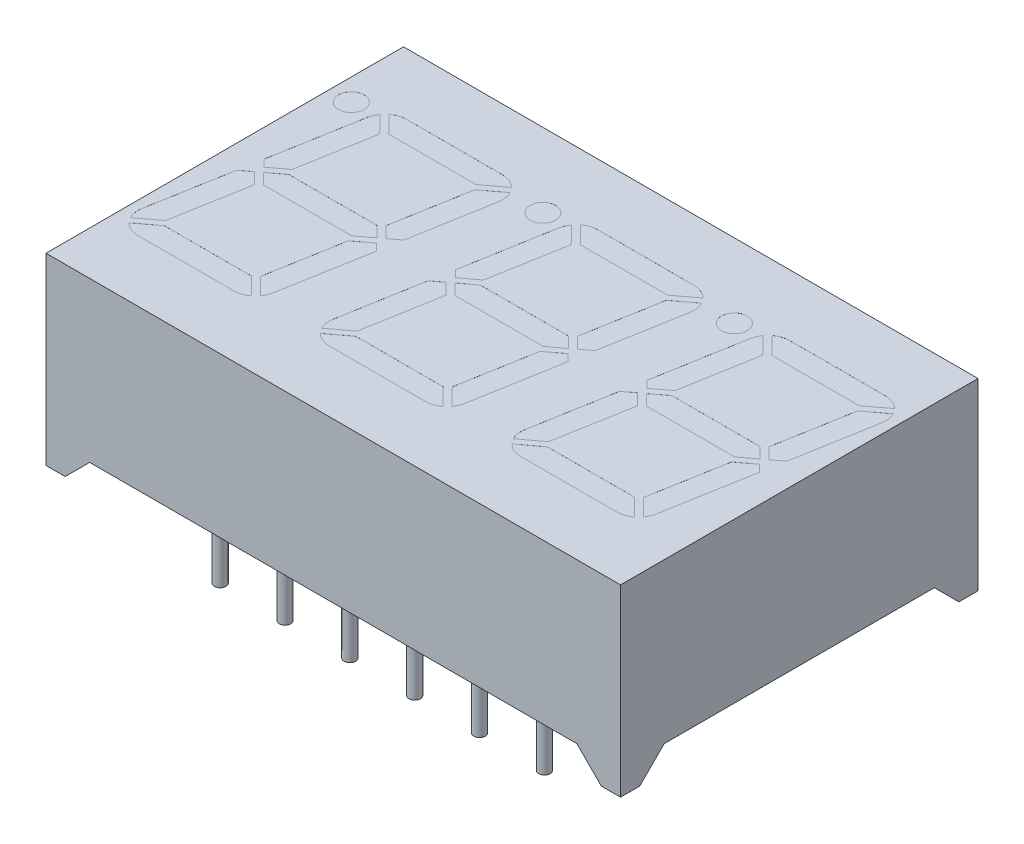
from build123d import *

# Parameters (mm, degrees)
SKETCH1_W                   = 22.5
SKETCH1_H                   = 14
BOSS_EXTRUDE1_DEPTH         = 7.2
CUT_EXTRUDE1_DEPTH          = 16.079870689
CUT_EXTRUDE1_DEPTH_BACK     = 16.079870689
CUT_EXTRUDE2_DEPTH          = 16.079870689
CUT_EXTRUDE2_DEPTH_BACK     = 16.079870689
SKETCH4_W                   = 22.1
SKETCH4_H                   = 13.6
CUT_EXTRUDE3_DEPTH          = 0.96
BOSS_EXTRUDE2_DEPTH         = 0.96
BOSS_EXTRUDE2_DEPTH_BACK    = 2.5
SKETCH5_R                   = 0.225
BOSS_EXTRUDE2_2_DEPTH       = 0.96
BOSS_EXTRUDE2_2_DEPTH_BACK  = 2.5
BOSS_EXTRUDE2_3_DEPTH       = 0.96
BOSS_EXTRUDE2_3_DEPTH_BACK  = 2.5
BOSS_EXTRUDE2_4_DEPTH       = 0.96
BOSS_EXTRUDE2_4_DEPTH_BACK  = 2.5
BOSS_EXTRUDE2_5_DEPTH       = 0.96
BOSS_EXTRUDE2_5_DEPTH_BACK  = 2.5
BOSS_EXTRUDE2_6_DEPTH       = 0.96
BOSS_EXTRUDE2_6_DEPTH_BACK  = 2.5
BOSS_EXTRUDE2_7_DEPTH       = 0.96
BOSS_EXTRUDE2_7_DEPTH_BACK  = 2.5
BOSS_EXTRUDE2_8_DEPTH       = 0.96
BOSS_EXTRUDE2_8_DEPTH_BACK  = 2.5
BOSS_EXTRUDE2_9_DEPTH       = 0.96
BOSS_EXTRUDE2_9_DEPTH_BACK  = 2.5
BOSS_EXTRUDE2_10_DEPTH      = 0.96
BOSS_EXTRUDE2_10_DEPTH_BACK = 2.5
BOSS_EXTRUDE2_11_DEPTH      = 0.96
BOSS_EXTRUDE2_11_DEPTH_BACK = 2.5
BOSS_EXTRUDE2_12_DEPTH      = 0.96
BOSS_EXTRUDE2_12_DEPTH_BACK = 2.5
SKETCH6_R                   = 0.5
CUT_EXTRUDE4_DEPTH          = 0.001
CUT_EXTRUDE5_DEPTH          = 0.001


with BuildPart() as part:
    # Sketch1 → Boss-Extrude1 (new body)
    with BuildSketch(Plane(origin=(0, 0, 0), x_dir=(1, 0, 0), z_dir=(0, 1, 0))):
        Rectangle(SKETCH1_W, SKETCH1_H)
    extrude(amount=BOSS_EXTRUDE1_DEPTH)

    # Sketch2 → Cut-Extrude1 (cut, two sides: drawn at the far end of the back side and taken through both)
    with BuildSketch(Plane.XY.offset(-CUT_EXTRUDE1_DEPTH_BACK)):
        Polygon((-10.5, 0), (-9.54, 0.96), (9.54, 0.96), (10.5, 0), align=None)
    extrude(amount=CUT_EXTRUDE1_DEPTH + CUT_EXTRUDE1_DEPTH_BACK, mode=Mode.SUBTRACT)

    # Sketch3 → Cut-Extrude2 (cut, two sides: drawn at the far end of the back side and taken through both)
    with BuildSketch(Plane(origin=(0, 0, 0), x_dir=(0, 0, -1), z_dir=(1, 0, 0)).offset(-CUT_EXTRUDE2_DEPTH_BACK)):
        Polygon((-6.25, 0), (-5.29, 0.96), (5.29, 0.96), (6.25, 0), align=None)
    extrude(amount=CUT_EXTRUDE2_DEPTH + CUT_EXTRUDE2_DEPTH_BACK, mode=Mode.SUBTRACT)

    # Sketch4 → Cut-Extrude3 (cut)
    with BuildSketch(Plane(origin=(0, 0, 0), x_dir=(1, 0, 0), z_dir=(0, 1, 0))):
        Rectangle(SKETCH4_W, SKETCH4_H)
    extrude(amount=CUT_EXTRUDE3_DEPTH, mode=Mode.SUBTRACT)

    # Sketch6 → Cut-Extrude4 (cut)
    with BuildSketch(Plane(origin=(0, 7.2, 0), x_dir=(1, 0, 0), z_dir=(0, 1, 0))):
        with Locations(Location((-10.392058442, 4.1, 0), (0, 0, 270))):
            Circle(SKETCH6_R)
        with Locations(Location((-2.892058442, 4.1, 0), (0, 0, 270))):
            Circle(SKETCH6_R)
        with Locations(Location((4.607941558, 4.1, 0), (0, 0, 270))):
            Circle(SKETCH6_R)
        with BuildLine():
            Line((-8.727547645, 4.6), (-4.970469181, 4.6))
            ThreePointArc((-4.970469181, 4.6), (-4.641426562, 4.533728879), (-4.363692234, 4.345249307))
            Line((-4.363692234, 4.345249307), (-5.155888885, 3.75))
            Line((-5.155888885, 3.75), (-8.578503163, 3.75))
            Line((-8.578503163, 3.75), (-9.237376372, 4.43012842))
            ThreePointArc((-9.237376372, 4.43012842), (-8.996239701, 4.556414644), (-8.727547645, 4.6))
        make_face()
        with BuildLine():
            Line((-4.133382591, 3.602399049), (-4.688947917, 0.451631512))
            Line((-4.688947917, 0.451631512), (-5.090743822, 0.149725749))
            Line((-5.090743822, 0.149725749), (-5.526060401, 0.599085615))
            Line((-5.526060401, 0.599085615), (-5.005711035, 3.550133511))
            Line((-5.005711035, 3.550133511), (-4.216751701, 4.142950328))
            ThreePointArc((-4.216751701, 4.142950328), (-4.130401732, 3.879563426), (-4.133382591, 3.602399049))
        make_face()
        with BuildLine():
            Line((-6.292921536, -4.6), (-10.05, -4.6))
            ThreePointArc((-10.05, -4.6), (-10.379042618, -4.533728879), (-10.656776946, -4.345249307))
            Line((-10.656776946, -4.345249307), (-9.864580296, -3.75))
            Line((-9.864580296, -3.75), (-6.441809911, -3.75))
            Line((-6.441809911, -3.75), (-5.783002379, -4.430060624))
            ThreePointArc((-5.783002379, -4.430060624), (-6.024175867, -4.556396779), (-6.292921536, -4.6))
        make_face()
        with BuildLine():
            Line((-10.88708659, -3.602399049), (-10.331521263, -0.451631512))
            Line((-10.331521263, -0.451631512), (-9.929635014, -0.149657865))
            Line((-9.929635014, -0.149657865), (-9.494384741, -0.598949286))
            Line((-9.494384741, -0.598949286), (-10.014758145, -3.550133511))
            Line((-10.014758145, -3.550133511), (-10.80371748, -4.142950328))
            ThreePointArc((-10.80371748, -4.142950328), (-10.890067449, -3.879563426), (-10.88708659, -3.602399049))
        make_face()
        with BuildLine():
            Line((-1.227547645, 4.6), (2.529530819, 4.6))
            ThreePointArc((2.529530819, 4.6), (2.858573438, 4.533728879), (3.136307766, 4.345249307))
            Line((3.136307766, 4.345249307), (2.344111115, 3.75))
            Line((2.344111115, 3.75), (-1.078503163, 3.75))
            Line((-1.078503163, 3.75), (-1.737376372, 4.43012842))
            ThreePointArc((-1.737376372, 4.43012842), (-1.496239701, 4.556414644), (-1.227547645, 4.6))
        make_face()
        with BuildLine():
            Line((-1.913379044, 4.252130751), (-1.258251642, 3.575868977))
            Line((-1.258251642, 3.575868977), (-1.773029585, 0.65641819))
            Line((-1.773029585, 0.65641819), (-2.403512913, 0.182678792))
            Line((-2.403512913, 0.182678792), (-2.670990276, 0.458784959))
            Line((-2.670990276, 0.458784959), (-2.064634235, 3.897600951))
            ThreePointArc((-2.064634235, 3.897600951), (-2.00936773, 4.083552626), (-1.913379044, 4.252130751))
        make_face()
        with BuildLine():
            Line((-9.413379044, 4.252130751), (-8.758251642, 3.575868977))
            Line((-8.758251642, 3.575868977), (-9.273029585, 0.65641819))
            Line((-9.273029585, 0.65641819), (-9.903512913, 0.182678792))
            Line((-9.903512913, 0.182678792), (-10.170990276, 0.458784959))
            Line((-10.170990276, 0.458784959), (-9.564634235, 3.897600951))
            ThreePointArc((-9.564634235, 3.897600951), (-9.50936773, 4.083552626), (-9.413379044, 4.252130751))
        make_face()
        Polygon((-2.22819342, 0.001703503), (-1.664903231, 0.424954592), (1.79419112, 0.424954592), (2.207603376, -0.001794319), (1.644313187, -0.425045408), (-1.814781164, -0.425045408), align=None)
        Polygon((-9.72819342, 0.001703503), (-9.164903231, 0.424954592), (-5.70580888, 0.424954592), (-5.292396624, -0.001794319), (-5.855686813, -0.425045408), (-9.314781164, -0.425045408), align=None)
        with BuildLine():
            Line((-6.262249697, -3.57605136), (-5.607180041, -4.252253524))
            ThreePointArc((-5.607180041, -4.252253524), (-5.511131311, -4.083622607), (-5.455834946, -3.897600951))
            Line((-5.455834946, -3.897600951), (-4.849511064, -0.458967341))
            Line((-4.849511064, -0.458967341), (-5.117077131, -0.182769608))
            Line((-5.117077131, -0.182769608), (-5.747439596, -0.65641819))
            Line((-5.747439596, -0.65641819), (-6.262249697, -3.57605136))
        make_face()
        with BuildLine():
            Line((-2.831521263, -0.451631512), (-2.429635014, -0.149657865))
            Line((-2.429635014, -0.149657865), (-1.994384741, -0.598949286))
            Line((-1.994384741, -0.598949286), (-2.514758145, -3.550133511))
            Line((-2.514758145, -3.550133511), (-3.30371748, -4.142950328))
            ThreePointArc((-3.30371748, -4.142950328), (-3.390067449, -3.879563426), (-3.38708659, -3.602399049))
            Line((-3.38708659, -3.602399049), (-2.831521263, -0.451631512))
        make_face()
        with BuildLine():
            Line((-3.156776946, -4.345249307), (-2.364580296, -3.75))
            Line((-2.364580296, -3.75), (1.058190089, -3.75))
            Line((1.058190089, -3.75), (1.716997621, -4.430060624))
            ThreePointArc((1.716997621, -4.430060624), (1.475824133, -4.556396779), (1.207078464, -4.6))
            Line((1.207078464, -4.6), (-2.55, -4.6))
            ThreePointArc((-2.55, -4.6), (-2.879042618, -4.533728879), (-3.156776946, -4.345249307))
        make_face()
        with BuildLine():
            Line((1.237750303, -3.57605136), (1.892819959, -4.252253524))
            ThreePointArc((1.892819959, -4.252253524), (1.988868689, -4.083622607), (2.044165054, -3.897600951))
            Line((2.044165054, -3.897600951), (2.650488936, -0.458967341))
            Line((2.650488936, -0.458967341), (2.382922869, -0.182769608))
            Line((2.382922869, -0.182769608), (1.752560404, -0.65641819))
            Line((1.752560404, -0.65641819), (1.237750303, -3.57605136))
        make_face()
        with BuildLine():
            Line((1.973939599, 0.599085615), (2.409256178, 0.149725749))
            Line((2.409256178, 0.149725749), (2.811052083, 0.451631512))
            Line((2.811052083, 0.451631512), (3.366617409, 3.602399049))
            ThreePointArc((3.366617409, 3.602399049), (3.369598268, 3.879563426), (3.283248299, 4.142950328))
            Line((3.283248299, 4.142950328), (2.494288965, 3.550133511))
            Line((2.494288965, 3.550133511), (1.973939599, 0.599085615))
        make_face()
        with BuildLine():
            Line((6.272452355, 4.6), (10.029530819, 4.6))
            ThreePointArc((10.029530819, 4.6), (10.358573438, 4.533728879), (10.636307766, 4.345249307))
            Line((10.636307766, 4.345249307), (9.844111115, 3.75))
            Line((9.844111115, 3.75), (6.421496837, 3.75))
            Line((6.421496837, 3.75), (5.762623628, 4.43012842))
            ThreePointArc((5.762623628, 4.43012842), (6.003760299, 4.556414644), (6.272452355, 4.6))
        make_face()
        with BuildLine():
            Line((5.586620956, 4.252130751), (6.241748358, 3.575868977))
            Line((6.241748358, 3.575868977), (5.726970415, 0.65641819))
            Line((5.726970415, 0.65641819), (5.096487087, 0.182678792))
            Line((5.096487087, 0.182678792), (4.829009724, 0.458784959))
            Line((4.829009724, 0.458784959), (5.435365765, 3.897600951))
            ThreePointArc((5.435365765, 3.897600951), (5.49063227, 4.083552626), (5.586620956, 4.252130751))
        make_face()
        Polygon((5.27180658, 0.001703503), (5.835096769, 0.424954592), (9.29419112, 0.424954592), (9.707603376, -0.001794319), (9.144313187, -0.425045408), (5.685218836, -0.425045408), align=None)
        with BuildLine():
            Line((4.668478737, -0.451631512), (5.070364986, -0.149657865))
            Line((5.070364986, -0.149657865), (5.505615259, -0.598949286))
            Line((5.505615259, -0.598949286), (4.985241855, -3.550133511))
            Line((4.985241855, -3.550133511), (4.19628252, -4.142950328))
            ThreePointArc((4.19628252, -4.142950328), (4.109932551, -3.879563426), (4.11291341, -3.602399049))
            Line((4.11291341, -3.602399049), (4.668478737, -0.451631512))
        make_face()
        with BuildLine():
            Line((4.343223054, -4.345249307), (5.135419704, -3.75))
            Line((5.135419704, -3.75), (8.558190089, -3.75))
            Line((8.558190089, -3.75), (9.216997621, -4.430060624))
            ThreePointArc((9.216997621, -4.430060624), (8.975824133, -4.556396779), (8.707078464, -4.6))
            Line((8.707078464, -4.6), (4.95, -4.6))
            ThreePointArc((4.95, -4.6), (4.620957382, -4.533728879), (4.343223054, -4.345249307))
        make_face()
        with BuildLine():
            Line((8.737750303, -3.57605136), (9.392819959, -4.252253524))
            ThreePointArc((9.392819959, -4.252253524), (9.488868689, -4.083622607), (9.544165054, -3.897600951))
            Line((9.544165054, -3.897600951), (10.150488936, -0.458967341))
            Line((10.150488936, -0.458967341), (9.882922869, -0.182769608))
            Line((9.882922869, -0.182769608), (9.252560404, -0.65641819))
            Line((9.252560404, -0.65641819), (8.737750303, -3.57605136))
        make_face()
        with BuildLine():
            Line((9.473939599, 0.599085615), (9.909256178, 0.149725749))
            Line((9.909256178, 0.149725749), (10.311052083, 0.451631512))
            Line((10.311052083, 0.451631512), (10.866617409, 3.602399049))
            ThreePointArc((10.866617409, 3.602399049), (10.869598268, 3.879563426), (10.783248299, 4.142950328))
            Line((10.783248299, 4.142950328), (9.994288965, 3.550133511))
            Line((9.994288965, 3.550133511), (9.473939599, 0.599085615))
        make_face()
    extrude(amount=-CUT_EXTRUDE4_DEPTH, mode=Mode.SUBTRACT)

    # Sketch7 → Cut-Extrude5 (cut)
    # profile 1 of 8: a face of its own
    with BuildSketch(Plane(origin=(0, 0, -7), x_dir=(-1, 0, 0), z_dir=(0, 0, -1))):
        with BuildLine():
            add(Edge.make_bspline(
                [(-6.587555337, 4.961124035), (-6.593219589, 4.967236914), (-6.604393745, 4.979296098), (-6.615160312, 5.001355167), (-6.62227472, 5.024800281), (-6.624655613, 5.049671139), (-6.622177743, 5.074691882), (-6.615323655, 5.098449351), (-6.604278793, 5.120539824), (-6.587949392, 5.139207064), (-6.569277137, 5.155555768), (-6.547187336, 5.166530211), (-6.523432095, 5.173650544), (-6.506856785, 5.174606093), (-6.498401377, 5.175093538)],
                knots=[0, 0, 0, 0, 1.009905308, 1.992290989, 2.955785953, 3.984032444, 5.012278935, 5.999725233, 6.982110915, 7.992016222, 9.00192153, 9.984307211, 10.971753509, 12, 12, 12, 12], degree=3))
            Line((-6.498401377, 5.175093538), (-5.873708805, 5.175093538))
            Line((-5.873708805, 5.175093538), (-5.248401377, 5.175093538))
            add(Edge.make_bspline(
                [(-5.248401377, 5.175093538), (-5.23995072, 5.174596897), (-5.223384722, 5.173623321), (-5.199737719, 5.166685451), (-5.178045317, 5.155351417), (-5.159456573, 5.139230017), (-5.143141878, 5.120533899), (-5.132093008, 5.098450791), (-5.125240638, 5.074691995), (-5.122759806, 5.049669081), (-5.125150627, 5.024808161), (-5.132230268, 5.001327493), (-5.14312838, 4.979403152), (-5.159460238, 4.960712225), (-5.17804439, 4.944589437), (-5.199737968, 4.933255758), (-5.223384656, 4.926317793), (-5.239950698, 4.92534423), (-5.248401377, 4.924847596)],
                knots=[0, 0, 0, 0, 1.030583013, 2.020273121, 2.982711463, 3.994911615, 5.007111767, 5.991729759, 6.981419867, 8.01200288, 9.042585892, 10.008270241, 10.992888233, 12.005088385, 13.017288537, 13.979726879, 14.969416987, 16, 16, 16, 16], degree=3))
            Line((-5.248401377, 4.924847596), (-5.748893261, 4.924847596))
            Line((-5.748893261, 4.924847596), (-5.748893261, 2.799909081))
            add(Edge.make_bspline(
                [(-5.748893261, 2.799909081), (-5.749356, 2.791446979), (-5.750252337, 2.775055657), (-5.757592417, 2.751572761), (-5.768420574, 2.729650289), (-5.784771755, 2.710953958), (-5.803350955, 2.694850646), (-5.825045019, 2.683447217), (-5.84869459, 2.676777516), (-5.873698734, 2.674259605), (-5.898565288, 2.676660073), (-5.922042398, 2.683738297), (-5.943975787, 2.694632934), (-5.962633076, 2.710980583), (-5.979000357, 2.72964337), (-5.989824338, 2.751574542), (-5.997165501, 2.775055181), (-5.998061688, 2.791446817), (-5.998524348, 2.799909081)],
                knots=[0, 0, 0, 0, 1.032249571, 1.999495531, 2.985705751, 3.999542735, 5.013379718, 5.977374421, 6.96866496, 8.000914531, 9.033164102, 10.000410062, 10.986620282, 12.000457265, 13.014294249, 14.000504469, 14.967750429, 16, 16, 16, 16], degree=3))
            Line((-5.998524348, 2.799909081), (-5.998524348, 4.924847596))
            Line((-5.998524348, 4.924847596), (-6.498401377, 4.924847596))
            add(Edge.make_bspline(
                [(-6.498401377, 4.924847596), (-6.506859188, 4.925332663), (-6.523439209, 4.926283549), (-6.54716025, 4.933437728), (-6.569379462, 4.944284103), (-6.581441175, 4.95545927), (-6.587555337, 4.961124035)],
                knots=[0, 0, 0, 0, 1.026198256, 2.011677592, 2.992106392, 4, 4, 4, 4], degree=3))
        make_face()
    # profile 2 of 8: a face of its own
    with BuildSketch(Plane(origin=(0, 0, -7), x_dir=(-1, 0, 0), z_dir=(0, 0, -1))):
        with BuildLine():
            add(Edge.make_bspline(
                [(-4.572060994, 5.029987783), (-4.553510328, 5.047548182), (-4.517001144, 5.082108444), (-4.457674577, 5.12737161), (-4.394926593, 5.164890777), (-4.329912054, 5.196617499), (-4.261740604, 5.220446312), (-4.191191183, 5.238127047), (-4.117542089, 5.247367431), (-4.042056146, 5.251497764), (-3.966569778, 5.247367886), (-3.89292191, 5.238125312), (-3.822368132, 5.22045265), (-3.754212802, 5.196593892), (-3.689295535, 5.1650565), (-3.626914693, 5.127224626), (-3.567932232, 5.081913176), (-3.511808721, 5.03084102), (-3.46077422, 4.974703913), (-3.415197736, 4.915671029), (-3.377972199, 4.852950615), (-3.345734643, 4.788176826), (-3.322332609, 4.719815193), (-3.304591351, 4.649128896), (-3.294934077, 4.57546603), (-3.293352129, 4.525422214), (-3.292547959, 4.499982864)],
                knots=[0, 0, 0, 0, 1.039409472, 2.045640428, 3.030085811, 4.011521354, 4.985266504, 5.964678503, 6.966472121, 8.002258777, 9.038045433, 10.039839051, 11.01925105, 11.992996201, 12.974431744, 13.951744785, 14.957975741, 15.997385213, 17.036794684, 18.043025641, 19.027471024, 20.001394879, 20.983007727, 21.962419726, 22.964213344, 24, 24, 24, 24], degree=3))
            Line((-3.292547959, 4.499982864), (-3.292547959, 3.350204212))
            add(Edge.make_bspline(
                [(-3.292547959, 3.350204212), (-3.293349674, 3.324763922), (-3.294926794, 3.274718255), (-3.30461911, 3.201068817), (-3.322184129, 3.130520746), (-3.346038886, 3.062344267), (-3.377776299, 2.99734865), (-3.415225773, 2.934529193), (-3.460765813, 2.875478263), (-3.511813125, 2.819352091), (-3.567923304, 2.768255044), (-3.626944623, 2.723028665), (-3.689112235, 2.684937045), (-3.754517027, 2.654530544), (-3.822206631, 2.629504868), (-3.89294767, 2.612129801), (-3.966563014, 2.602798854), (-4.04205617, 2.598699629), (-4.117548762, 2.602799391), (-4.191165728, 2.612127754), (-4.261900995, 2.629512352), (-4.329611966, 2.654502655), (-4.395095893, 2.685115567), (-4.457701734, 2.722824575), (-4.51678848, 2.768281802), (-4.572913319, 2.819346931), (-4.62397862, 2.875471816), (-4.669435227, 2.93455855), (-4.707146478, 2.997164394), (-4.737751114, 3.062648321), (-4.76277226, 3.13035929), (-4.780040569, 3.201094565), (-4.789817874, 3.2747115), (-4.791383283, 3.324761645), (-4.792179046, 3.350204212)],
                knots=[0, 0, 0, 0, 1.035799714, 2.037605962, 3.017030308, 3.990787735, 4.97223565, 5.956693444, 6.962937086, 8.002359661, 9.041782236, 10.048025879, 11.02535124, 12.003210669, 12.979787845, 13.959212191, 14.961018439, 15.996818153, 17.032617867, 18.034424114, 19.013848461, 19.990425637, 20.968285066, 21.952742859, 22.958986501, 23.998409076, 25.037831652, 26.044075294, 27.028533087, 28.006392516, 28.982969692, 29.962394038, 30.964200286, 32, 32, 32, 32], degree=3))
            Line((-4.792179046, 3.350204212), (-4.792179046, 4.499982864))
            add(Edge.make_bspline(
                [(-4.792179046, 4.499982864), (-4.791380826, 4.525424497), (-4.789810582, 4.575472804), (-4.780068362, 4.649103075), (-4.762624502, 4.71997665), (-4.738051841, 4.787868336), (-4.706965127, 4.85315114), (-4.669405928, 4.915584112), (-4.624191844, 4.974932453), (-4.589624826, 5.01143864), (-4.572060994, 5.029987783)],
                knots=[0, 0, 0, 0, 1.035554207, 2.037123005, 3.016315207, 4.000504314, 4.970594194, 5.954818649, 6.96082379, 8, 8, 8, 8], degree=3))
        make_face()
        with BuildLine():
            add(Edge.make_bspline(
                [(-3.68974422, 4.852294718), (-3.702018176, 4.864033723), (-3.726357572, 4.887312306), (-3.766317834, 4.917161988), (-3.807918501, 4.942621459), (-3.851173288, 4.963978763), (-3.896755705, 4.97954075), (-3.943776452, 4.991661504), (-3.99267471, 4.998082026), (-4.042670384, 5.000760289), (-4.092669299, 4.998087401), (-4.141558167, 4.991640869), (-4.18842501, 4.979664628), (-4.23370724, 4.963831405), (-4.276806461, 4.942630611), (-4.318438418, 4.917188249), (-4.358248927, 4.887192063), (-4.395442269, 4.85275628), (-4.429894312, 4.815566808), (-4.459823489, 4.775725403), (-4.485461309, 4.734283842), (-4.505750218, 4.690849559), (-4.521802413, 4.645760237), (-4.533640129, 4.598863775), (-4.540397853, 4.549982749), (-4.541416455, 4.516809039), (-4.541933104, 4.499982864)],
                knots=[0, 0, 0, 0, 1.037620236, 2.057612961, 3.041882263, 4.017016246, 4.999848775, 5.981482385, 6.980948767, 8.009678534, 9.038408301, 10.037874683, 11.019508294, 11.990527598, 12.965661581, 13.949930883, 14.969923608, 16.007543845, 17.045164081, 18.065156806, 19.049426108, 20.019150936, 20.990170241, 21.971803851, 22.971270233, 24, 24, 24, 24], degree=3))
            Line((-4.541933104, 4.499982864), (-4.541933104, 3.350204212))
            add(Edge.make_bspline(
                [(-4.541933104, 3.350204212), (-4.541417044, 3.333377762), (-4.540399603, 3.30020351), (-4.53363341, 3.251326434), (-4.521827022, 3.204415363), (-4.505596655, 3.159204957), (-4.485640477, 3.11540868), (-4.459800677, 3.073857622), (-4.429901097, 3.034001454), (-4.395438683, 2.99682067), (-4.358256364, 2.96236536), (-4.318413087, 2.932436655), (-4.276972007, 2.906800082), (-4.233537595, 2.886505849), (-4.18844832, 2.870473773), (-4.141551801, 2.858559624), (-4.09267096, 2.852095693), (-4.042670372, 2.849428795), (-3.992673098, 2.852101113), (-3.943782652, 2.858538817), (-3.896732881, 2.870598035), (-3.851342068, 2.886359185), (-3.807761218, 2.906817617), (-3.766311929, 2.932431624), (-3.726472145, 2.962367206), (-3.68928429, 2.996818459), (-3.654840388, 3.034008376), (-3.624874205, 3.073832975), (-3.599227449, 3.115571554), (-3.578366034, 3.159037991), (-3.562333314, 3.204438123), (-3.550465582, 3.251320219), (-3.543715974, 3.300205129), (-3.542696259, 3.333378307), (-3.542179046, 3.350204212)],
                knots=[0, 0, 0, 0, 1.028418595, 2.027582657, 3.008919341, 3.97964493, 4.960421788, 5.944393367, 6.964077562, 8.001383937, 9.038690313, 10.058374508, 11.042346087, 12.011777591, 12.98250318, 13.963839865, 14.963003926, 15.991422521, 17.019841116, 18.019005178, 19.000341862, 19.982877102, 20.952308605, 21.936280184, 22.95596438, 23.993270755, 25.03057713, 26.050261326, 27.034232905, 28.02035507, 28.991080659, 29.972417343, 30.971581405, 32, 32, 32, 32], degree=3))
            Line((-3.542179046, 3.350204212), (-3.542179046, 4.499982864))
            add(Edge.make_bspline(
                [(-3.542179046, 4.499982864), (-3.542696845, 4.516808495), (-3.543717715, 4.549981133), (-3.550458897, 4.59886998), (-3.562357793, 4.645737515), (-3.578213957, 4.691017031), (-3.599399057, 4.734126474), (-3.62488208, 4.775719424), (-3.654725305, 4.815681802), (-3.67800477, 4.840020909), (-3.68974422, 4.852294718)],
                knots=[0, 0, 0, 0, 1.029004343, 2.028737489, 3.010633105, 3.981911582, 4.957305836, 5.941837847, 6.962102815, 8, 8, 8, 8], degree=3))
        make_face(mode=Mode.SUBTRACT)
    # profile 3 of 8: a face of its own
    with BuildSketch(Plane(origin=(0, 0, -7), x_dir=(-1, 0, 0), z_dir=(0, 0, -1))):
        with BuildLine():
            add(Edge.make_bspline(
                [(-2.888588293, 4.961124035), (-2.894252546, 4.967236914), (-2.905426701, 4.979296098), (-2.916193268, 5.001355167), (-2.923307676, 5.024800281), (-2.925688569, 5.049671139), (-2.923210699, 5.074691882), (-2.916356612, 5.098449351), (-2.905311749, 5.120539824), (-2.888982348, 5.139207064), (-2.870310093, 5.155555768), (-2.848220293, 5.166530211), (-2.824465051, 5.173650544), (-2.807889741, 5.174606093), (-2.799434333, 5.175093538)],
                knots=[0, 0, 0, 0, 1.009905308, 1.992290989, 2.955785953, 3.984032444, 5.012278935, 5.999725233, 6.982110915, 7.992016222, 9.00192153, 9.984307211, 10.971753509, 12, 12, 12, 12], degree=3))
            Line((-2.799434333, 5.175093538), (-2.174741761, 5.175093538))
            Line((-2.174741761, 5.175093538), (-1.549434333, 5.175093538))
            add(Edge.make_bspline(
                [(-1.549434333, 5.175093538), (-1.540983676, 5.174596897), (-1.524417678, 5.173623321), (-1.500770675, 5.166685451), (-1.479078273, 5.155351417), (-1.46048953, 5.139230017), (-1.444174834, 5.120533899), (-1.433125964, 5.098450791), (-1.426273594, 5.074691995), (-1.423792762, 5.049669081), (-1.426183583, 5.024808161), (-1.433263224, 5.001327493), (-1.444161336, 4.979403152), (-1.460493194, 4.960712225), (-1.479077346, 4.944589437), (-1.500770924, 4.933255758), (-1.524417612, 4.926317793), (-1.540983654, 4.92534423), (-1.549434333, 4.924847596)],
                knots=[0, 0, 0, 0, 1.030583013, 2.020273121, 2.982711463, 3.994911615, 5.007111767, 5.991729759, 6.981419867, 8.01200288, 9.042585892, 10.008270241, 10.992888233, 12.005088385, 13.017288537, 13.979726879, 14.969416987, 16, 16, 16, 16], degree=3))
            Line((-1.549434333, 4.924847596), (-2.049926217, 4.924847596))
            Line((-2.049926217, 4.924847596), (-2.049926217, 2.799909081))
            add(Edge.make_bspline(
                [(-2.049926217, 2.799909081), (-2.050388956, 2.791446979), (-2.051285293, 2.775055657), (-2.058625373, 2.751572761), (-2.06945353, 2.729650289), (-2.085804711, 2.710953958), (-2.104383911, 2.694850646), (-2.126077975, 2.683447217), (-2.149727546, 2.676777516), (-2.17473169, 2.674259605), (-2.199598244, 2.676660073), (-2.223075354, 2.683738297), (-2.245008743, 2.694632934), (-2.263666032, 2.710980583), (-2.280033313, 2.72964337), (-2.290857294, 2.751574542), (-2.298198457, 2.775055181), (-2.299094644, 2.791446817), (-2.299557304, 2.799909081)],
                knots=[0, 0, 0, 0, 1.032249571, 1.999495531, 2.985705751, 3.999542735, 5.013379718, 5.977374421, 6.96866496, 8.000914531, 9.033164102, 10.000410062, 10.986620282, 12.000457265, 13.014294249, 14.000504469, 14.967750429, 16, 16, 16, 16], degree=3))
            Line((-2.299557304, 2.799909081), (-2.299557304, 4.924847596))
            Line((-2.299557304, 4.924847596), (-2.799434333, 4.924847596))
            add(Edge.make_bspline(
                [(-2.799434333, 4.924847596), (-2.807892144, 4.925332663), (-2.824472165, 4.926283549), (-2.848193206, 4.933437728), (-2.870412418, 4.944284103), (-2.882474132, 4.95545927), (-2.888588293, 4.961124035)],
                knots=[0, 0, 0, 0, 1.026198256, 2.011677592, 2.992106392, 4, 4, 4, 4], degree=3))
        make_face()
    # profile 4 of 8: a face of its own
    with BuildSketch(Plane(origin=(0, 0, -7), x_dir=(-1, 0, 0), z_dir=(0, 0, -1))):
        with BuildLine():
            Line((-0.943187408, 3.674847596), (0.05656665, 3.674847596))
            add(Edge.make_bspline(
                [(0.05656665, 3.674847596), (0.065021918, 3.67436008), (0.081596952, 3.673404392), (0.105354191, 3.666285069), (0.127436434, 3.655306803), (0.146137678, 3.638972762), (0.162239675, 3.620388977), (0.173643441, 3.598696087), (0.180313049, 3.575046201), (0.182830993, 3.550042123), (0.180430492, 3.525175635), (0.173352361, 3.501698215), (0.162457379, 3.479766021), (0.146111053, 3.461104123), (0.127443348, 3.444753983), (0.105352361, 3.433779914), (0.081597433, 3.426659482), (0.06502208, 3.425703947), (0.05656665, 3.425216509)],
                knots=[0, 0, 0, 0, 1.029156367, 2.017476438, 3.000731414, 4.011530369, 5.022329323, 5.983435352, 6.971755423, 8.000911791, 9.030068158, 9.994415701, 10.977670677, 11.988469631, 12.999268586, 13.982523562, 14.970843633, 16, 16, 16, 16], degree=3))
            Line((0.05656665, 3.425216509), (-0.943187408, 3.425216509))
            add(Edge.make_bspline(
                [(-0.943187408, 3.425216509), (-0.951641973, 3.425704659), (-0.968215631, 3.426661591), (-0.991982862, 3.433771883), (-1.014027298, 3.444784321), (-1.032774019, 3.460901716), (-1.048398037, 3.479986136), (-1.059390622, 3.50167167), (-1.066426561, 3.525182734), (-1.068841983, 3.550042132), (-1.066308956, 3.575039011), (-1.059682458, 3.598723199), (-1.04818554, 3.62017254), (-1.032800803, 3.639175362), (-1.014020297, 3.655276393), (-0.991984715, 3.666293119), (-0.968215145, 3.673402278), (-0.951641809, 3.674359366), (-0.943187408, 3.674847596)],
                knots=[0, 0, 0, 0, 1.031202024, 2.021486582, 3.006695977, 4.019504099, 5.016410598, 6.001619993, 6.967884373, 7.999086397, 9.030288422, 10.020572979, 10.983589402, 11.980495901, 12.993304023, 13.978513418, 14.968797976, 16, 16, 16, 16], degree=3))
        make_face()
    # profile 5 of 8: a face of its own
    with BuildSketch(Plane(origin=(0, 0, -7), x_dir=(-1, 0, 0), z_dir=(0, 0, -1))):
        with BuildLine():
            Line((0.788243974, 5.175093538), (1.288121003, 5.175093538))
            add(Edge.make_bspline(
                [(1.288121003, 5.175093538), (1.309465458, 5.174477484), (1.351509672, 5.173263984), (1.413282254, 5.16441911), (1.472583865, 5.150288039), (1.529610134, 5.130671887), (1.583862874, 5.104553827), (1.635728876, 5.07302025), (1.685355437, 5.035963023), (1.731319546, 4.992984653), (1.774297916, 4.947020544), (1.811355143, 4.897393983), (1.84288872, 4.845527981), (1.86900678, 4.791275241), (1.888622932, 4.734248972), (1.902754003, 4.674947361), (1.911598877, 4.613174779), (1.912812377, 4.571130565), (1.913428431, 4.54978611)],
                knots=[0, 0, 0, 0, 1.040782002, 2.050127882, 3.036898077, 4.010569535, 4.985266666, 5.967571354, 6.967168716, 8, 9.032831284, 10.032428646, 11.014733334, 11.989430465, 12.963101923, 13.949872118, 14.959217998, 16, 16, 16, 16], degree=3))
            add(Edge.make_bspline(
                [(1.913428431, 4.54978611), (1.91257007, 4.525141319), (1.910871147, 4.476362756), (1.898197285, 4.404279961), (1.877308581, 4.334738658), (1.848189774, 4.268205823), (1.812208821, 4.205454481), (1.768553139, 4.148122206), (1.719553297, 4.095175306), (1.682029839, 4.065043659), (1.663182489, 4.049909081)],
                knots=[0, 0, 0, 0, 1.020341526, 2.019525832, 3.021194914, 4.020991984, 5.021221367, 6.009274474, 7.000094834, 8, 8, 8, 8], degree=3))
            add(Edge.make_bspline(
                [(1.663182489, 4.049909081), (1.682055648, 4.035009278), (1.719733086, 4.005264051), (1.76850692, 3.95227058), (1.812412532, 3.894895548), (1.848014106, 3.83171457), (1.877336486, 3.76509578), (1.898189863, 3.695533873), (1.910873047, 3.623456515), (1.912570708, 3.574677216), (1.913428431, 3.550032052)],
                knots=[0, 0, 0, 0, 0.994213465, 1.984798401, 2.972616741, 3.979963423, 4.979522937, 5.980954017, 6.979900912, 8, 8, 8, 8], degree=3))
            Line((1.913428431, 3.550032052), (1.913428431, 3.29978611))
            add(Edge.make_bspline(
                [(1.913428431, 3.29978611), (1.912824774, 3.278440013), (1.911641435, 3.236595577), (1.902683324, 3.175045211), (1.888629123, 3.115937276), (1.869005129, 3.058912056), (1.842889166, 3.004659035), (1.811355021, 2.952793109), (1.77429795, 2.903166527), (1.731319536, 2.857202424), (1.685355439, 2.814224052), (1.635728876, 2.777166826), (1.583862874, 2.745633249), (1.529610134, 2.719515189), (1.472583865, 2.699899036), (1.413282254, 2.685767966), (1.351509672, 2.676923092), (1.309465458, 2.675709592), (1.288121003, 2.675093538)],
                knots=[0, 0, 0, 0, 1.041426285, 2.041492391, 3.028873433, 4.00314763, 4.978448135, 5.961360907, 6.961577057, 7.995047702, 9.028518346, 10.028734496, 11.011647268, 11.986947773, 12.96122197, 13.948603012, 14.958573715, 16, 16, 16, 16], degree=3))
            Line((1.288121003, 2.675093538), (0.788243974, 2.675093538))
            add(Edge.make_bspline(
                [(0.788243974, 2.675093538), (0.779789409, 2.675581689), (0.76321575, 2.676538621), (0.739448523, 2.683648911), (0.717404073, 2.694661355), (0.698657403, 2.710778724), (0.683033199, 2.72986324), (0.672041294, 2.751548425), (0.665002816, 2.775060793), (0.662597451, 2.799915026), (0.665092945, 2.824931183), (0.671903135, 2.848722447), (0.683046362, 2.870565846), (0.698653793, 2.889655372), (0.717405017, 2.905771381), (0.739448273, 2.916784181), (0.763215816, 2.923894377), (0.779789431, 2.924851322), (0.788243974, 2.92533948)],
                knots=[0, 0, 0, 0, 1.029773666, 2.018686541, 3.002531284, 4.013936525, 5.00946217, 5.993306912, 6.958232881, 7.988006547, 9.017780212, 10.006693088, 10.99053783, 11.986063475, 12.997468716, 13.981313459, 14.970226334, 16, 16, 16, 16], degree=3))
            Line((0.788243974, 2.92533948), (1.288121003, 2.92533948))
            add(Edge.make_bspline(
                [(1.288121003, 2.92533948), (1.313083208, 2.92652372), (1.362289616, 2.928858136), (1.432658063, 2.950889047), (1.497703766, 2.985249206), (1.55467406, 3.033256573), (1.602540238, 3.090366752), (1.637770418, 3.155067677), (1.659620564, 3.225640238), (1.661983687, 3.27483156), (1.663182489, 3.29978611)],
                knots=[0, 0, 0, 0, 1.015341667, 2.001478568, 2.977257087, 3.998017972, 5.018778858, 5.998521432, 6.984658333, 8, 8, 8, 8], degree=3))
            Line((1.663182489, 3.29978611), (1.663182489, 3.550032052))
            add(Edge.make_bspline(
                [(1.663182489, 3.550032052), (1.661983523, 3.574986301), (1.659620079, 3.624177028), (1.637772291, 3.694753944), (1.602533139, 3.759438295), (1.55470181, 3.816612859), (1.497527246, 3.864444188), (1.432842895, 3.899683339), (1.362265979, 3.921531128), (1.313075252, 3.923894572), (1.288121003, 3.925093538)],
                knots=[0, 0, 0, 0, 1.014838807, 2.000487313, 2.979744658, 4, 5.020255342, 5.999512687, 6.985161193, 8, 8, 8, 8], degree=3))
            Line((1.288121003, 3.925093538), (1.037875061, 3.925093538))
            add(Edge.make_bspline(
                [(1.037875061, 3.925093538), (1.029412797, 3.925556199), (1.01302116, 3.926452385), (0.989540525, 3.933793547), (0.96760934, 3.944617535), (0.948946604, 3.960984789), (0.932598766, 3.979642175), (0.921704809, 4.001575215), (0.914624051, 4.025053627), (0.912233624, 4.049915022), (0.914714059, 4.074938418), (0.921567573, 4.098694903), (0.932612266, 4.120786754), (0.948942941, 4.139449338), (0.967610292, 4.155815195), (0.98954028, 4.166639545), (1.013021226, 4.173980612), (1.029412819, 4.174876812), (1.037875061, 4.17533948)],
                knots=[0, 0, 0, 0, 1.030818311, 1.996723141, 2.981565937, 3.99399719, 5.006428443, 5.991271239, 6.957176069, 7.98799438, 9.018812691, 10.008728761, 10.993571557, 12.00600281, 13.018434063, 14.003276859, 14.969181689, 16, 16, 16, 16], degree=3))
            Line((1.037875061, 4.17533948), (1.288121003, 4.17533948))
            add(Edge.make_bspline(
                [(1.288121003, 4.17533948), (1.313083144, 4.17652372), (1.362289427, 4.178858136), (1.432658791, 4.200889047), (1.497701012, 4.235249205), (1.554684874, 4.283256574), (1.60250062, 4.340366747), (1.63791205, 4.405067695), (1.659080743, 4.47564017), (1.66526341, 4.549786372), (1.659080258, 4.623931018), (1.637913922, 4.69450802), (1.602493521, 4.759192348), (1.554712624, 4.816366919), (1.497524479, 4.864198245), (1.432843625, 4.899437398), (1.36226579, 4.921285186), (1.313075189, 4.92364863), (1.288121003, 4.924847596)],
                knots=[0, 0, 0, 0, 1.015090175, 2.000982818, 2.976519644, 3.997027695, 5.017535746, 5.997035646, 6.982928288, 7.998018463, 9.013108638, 9.999001281, 10.978501181, 11.999009232, 13.019517283, 13.999017182, 14.984909825, 16, 16, 16, 16], degree=3))
            Line((1.288121003, 4.924847596), (0.788243974, 4.924847596))
            add(Edge.make_bspline(
                [(0.788243974, 4.924847596), (0.779789409, 4.925335747), (0.76321575, 4.926292679), (0.739448523, 4.933402969), (0.717404073, 4.944415413), (0.698657403, 4.960532782), (0.683033199, 4.979617298), (0.672041294, 5.001302483), (0.665002816, 5.024814851), (0.662597451, 5.049669084), (0.665092945, 5.074685241), (0.671903135, 5.098476505), (0.683046362, 5.120319904), (0.698653793, 5.13940943), (0.717405017, 5.155525439), (0.739448273, 5.166538239), (0.763215816, 5.173648435), (0.779789431, 5.17460538), (0.788243974, 5.175093538)],
                knots=[0, 0, 0, 0, 1.029773666, 2.018686541, 3.002531284, 4.013936525, 5.00946217, 5.993306912, 6.958232881, 7.988006547, 9.017780212, 10.006693088, 10.99053783, 11.986063475, 12.997468716, 13.981313459, 14.970226334, 16, 16, 16, 16], degree=3))
        make_face()
    # profile 6 of 8: a face of its own
    with BuildSketch(Plane(origin=(0, 0, -7), x_dir=(-1, 0, 0), z_dir=(0, 0, -1))):
        with BuildLine():
            Line((2.519675357, 5.175093538), (3.019552386, 5.175093538))
            add(Edge.make_bspline(
                [(3.019552386, 5.175093538), (3.04089684, 5.174477484), (3.082941054, 5.173263984), (3.144713636, 5.16441911), (3.204015247, 5.150288039), (3.261041516, 5.130671887), (3.315294256, 5.104553827), (3.367160258, 5.07302025), (3.416786819, 5.035963023), (3.462750928, 4.992984653), (3.505729298, 4.947020544), (3.542786525, 4.897393983), (3.574320102, 4.845527981), (3.600438162, 4.791275241), (3.620054315, 4.734248972), (3.634185385, 4.674947361), (3.643030259, 4.613174779), (3.644243759, 4.571130565), (3.644859813, 4.54978611)],
                knots=[0, 0, 0, 0, 1.040782002, 2.050127882, 3.036898077, 4.010569535, 4.985266666, 5.967571354, 6.967168716, 8, 9.032831284, 10.032428646, 11.014733334, 11.989430465, 12.963101923, 13.949872118, 14.959217998, 16, 16, 16, 16], degree=3))
            add(Edge.make_bspline(
                [(3.644859813, 4.54978611), (3.644001452, 4.525141319), (3.64230253, 4.476362756), (3.629628667, 4.404279961), (3.608739963, 4.334738658), (3.579621156, 4.268205823), (3.543640203, 4.205454481), (3.499984521, 4.148122206), (3.450984679, 4.095175306), (3.413461221, 4.065043659), (3.394613871, 4.049909081)],
                knots=[0, 0, 0, 0, 1.020341526, 2.019525832, 3.021194914, 4.020991984, 5.021221367, 6.009274474, 7.000094834, 8, 8, 8, 8], degree=3))
            add(Edge.make_bspline(
                [(3.394613871, 4.049909081), (3.41348703, 4.035009278), (3.451164468, 4.005264051), (3.499938302, 3.95227058), (3.543843914, 3.894895548), (3.579445488, 3.83171457), (3.608767868, 3.76509578), (3.629621246, 3.695533873), (3.642304429, 3.623456515), (3.64400209, 3.574677216), (3.644859813, 3.550032052)],
                knots=[0, 0, 0, 0, 0.994213465, 1.984798401, 2.972616741, 3.979963423, 4.979522937, 5.980954017, 6.979900912, 8, 8, 8, 8], degree=3))
            Line((3.644859813, 3.550032052), (3.644859813, 3.29978611))
            add(Edge.make_bspline(
                [(3.644859813, 3.29978611), (3.644256156, 3.278440013), (3.643072817, 3.236595577), (3.634114707, 3.175045211), (3.620060505, 3.115937276), (3.600436512, 3.058912056), (3.574320548, 3.004659035), (3.542786403, 2.952793109), (3.505729333, 2.903166527), (3.462750918, 2.857202424), (3.416786822, 2.814224052), (3.367160258, 2.777166826), (3.315294256, 2.745633249), (3.261041516, 2.719515189), (3.204015247, 2.699899036), (3.144713636, 2.685767966), (3.082941054, 2.676923092), (3.04089684, 2.675709592), (3.019552386, 2.675093538)],
                knots=[0, 0, 0, 0, 1.041426285, 2.041492391, 3.028873433, 4.00314763, 4.978448135, 5.961360907, 6.961577057, 7.995047702, 9.028518346, 10.028734496, 11.011647268, 11.986947773, 12.96122197, 13.948603012, 14.958573715, 16, 16, 16, 16], degree=3))
            Line((3.019552386, 2.675093538), (2.519675357, 2.675093538))
            add(Edge.make_bspline(
                [(2.519675357, 2.675093538), (2.511220791, 2.675581689), (2.494647132, 2.676538621), (2.470879905, 2.683648911), (2.448835456, 2.694661355), (2.430088786, 2.710778724), (2.414464581, 2.72986324), (2.403472676, 2.751548425), (2.396434198, 2.775060793), (2.394028833, 2.799915026), (2.396524327, 2.824931183), (2.403334517, 2.848722447), (2.414477744, 2.870565846), (2.430085175, 2.889655372), (2.448836399, 2.905771381), (2.470879655, 2.916784181), (2.494647198, 2.923894377), (2.511220813, 2.924851322), (2.519675357, 2.92533948)],
                knots=[0, 0, 0, 0, 1.029773666, 2.018686541, 3.002531284, 4.013936525, 5.00946217, 5.993306912, 6.958232881, 7.988006547, 9.017780212, 10.006693088, 10.99053783, 11.986063475, 12.997468716, 13.981313459, 14.970226334, 16, 16, 16, 16], degree=3))
            Line((2.519675357, 2.92533948), (3.019552386, 2.92533948))
            add(Edge.make_bspline(
                [(3.019552386, 2.92533948), (3.04451459, 2.92652372), (3.093720999, 2.928858136), (3.164089445, 2.950889047), (3.229135148, 2.985249206), (3.286105442, 3.033256573), (3.33397162, 3.090366752), (3.369201801, 3.155067677), (3.391051947, 3.225640238), (3.393415069, 3.27483156), (3.394613871, 3.29978611)],
                knots=[0, 0, 0, 0, 1.015341667, 2.001478568, 2.977257087, 3.998017972, 5.018778858, 5.998521432, 6.984658333, 8, 8, 8, 8], degree=3))
            Line((3.394613871, 3.29978611), (3.394613871, 3.550032052))
            add(Edge.make_bspline(
                [(3.394613871, 3.550032052), (3.393414906, 3.574986301), (3.391051461, 3.624177028), (3.369203673, 3.694753944), (3.333964521, 3.759438295), (3.286133193, 3.816612859), (3.228958628, 3.864444188), (3.164274278, 3.899683339), (3.093697361, 3.921531128), (3.044506634, 3.923894572), (3.019552386, 3.925093538)],
                knots=[0, 0, 0, 0, 1.014838807, 2.000487313, 2.979744658, 4, 5.020255342, 5.999512687, 6.985161193, 8, 8, 8, 8], degree=3))
            Line((3.019552386, 3.925093538), (2.769306444, 3.925093538))
            add(Edge.make_bspline(
                [(2.769306444, 3.925093538), (2.760844179, 3.925556199), (2.744452543, 3.926452385), (2.720971907, 3.933793547), (2.699040722, 3.944617535), (2.680377986, 3.960984789), (2.664030148, 3.979642175), (2.653136191, 4.001575215), (2.646055433, 4.025053627), (2.643665007, 4.049915022), (2.646145441, 4.074938418), (2.652998955, 4.098694903), (2.664043649, 4.120786754), (2.680374323, 4.139449338), (2.699041674, 4.155815195), (2.720971662, 4.166639545), (2.744452608, 4.173980612), (2.760844202, 4.174876812), (2.769306444, 4.17533948)],
                knots=[0, 0, 0, 0, 1.030818311, 1.996723141, 2.981565937, 3.99399719, 5.006428443, 5.991271239, 6.957176069, 7.98799438, 9.018812691, 10.008728761, 10.993571557, 12.00600281, 13.018434063, 14.003276859, 14.969181689, 16, 16, 16, 16], degree=3))
            Line((2.769306444, 4.17533948), (3.019552386, 4.17533948))
            add(Edge.make_bspline(
                [(3.019552386, 4.17533948), (3.044514526, 4.17652372), (3.09372081, 4.178858136), (3.164090173, 4.200889047), (3.229132394, 4.235249205), (3.286116256, 4.283256574), (3.333932002, 4.340366747), (3.369343432, 4.405067695), (3.390512126, 4.47564017), (3.396694793, 4.549786372), (3.39051164, 4.623931018), (3.369345304, 4.69450802), (3.333924903, 4.759192348), (3.286144006, 4.816366919), (3.228955862, 4.864198245), (3.164275007, 4.899437398), (3.093697172, 4.921285186), (3.044506571, 4.92364863), (3.019552386, 4.924847596)],
                knots=[0, 0, 0, 0, 1.015090175, 2.000982818, 2.976519644, 3.997027695, 5.017535746, 5.997035646, 6.982928288, 7.998018463, 9.013108638, 9.999001281, 10.978501181, 11.999009232, 13.019517283, 13.999017182, 14.984909825, 16, 16, 16, 16], degree=3))
            Line((3.019552386, 4.924847596), (2.519675357, 4.924847596))
            add(Edge.make_bspline(
                [(2.519675357, 4.924847596), (2.511220791, 4.925335747), (2.494647132, 4.926292679), (2.470879905, 4.933402969), (2.448835456, 4.944415413), (2.430088786, 4.960532782), (2.414464581, 4.979617298), (2.403472676, 5.001302483), (2.396434198, 5.024814851), (2.394028833, 5.049669084), (2.396524327, 5.074685241), (2.403334517, 5.098476505), (2.414477744, 5.120319904), (2.430085175, 5.13940943), (2.448836399, 5.155525439), (2.470879655, 5.166538239), (2.494647198, 5.173648435), (2.511220813, 5.17460538), (2.519675357, 5.175093538)],
                knots=[0, 0, 0, 0, 1.029773666, 2.018686541, 3.002531284, 4.013936525, 5.00946217, 5.993306912, 6.958232881, 7.988006547, 9.017780212, 10.006693088, 10.99053783, 11.986063475, 12.997468716, 13.981313459, 14.970226334, 16, 16, 16, 16], degree=3))
        make_face()
    # profile 7 of 8: a face of its own
    with BuildSketch(Plane(origin=(0, 0, -7), x_dir=(-1, 0, 0), z_dir=(0, 0, -1))):
        with BuildLine():
            add(Edge.make_bspline(
                [(5.193679292, 2.782693144), (5.178405115, 2.767998419), (5.148348245, 2.739081808), (5.098557932, 2.702187871), (5.046734526, 2.670613407), (4.992470532, 2.644500286), (4.935447259, 2.624904754), (4.876144895, 2.610684478), (4.814372276, 2.602187366), (4.750984564, 2.599013887), (4.687592121, 2.602180052), (4.625833169, 2.610712444), (4.566670886, 2.624758202), (4.509824396, 2.644798028), (4.455357735, 2.670428386), (4.403379657, 2.702173594), (4.353778586, 2.739234153), (4.307761255, 2.78198221), (4.265454006, 2.828370509), (4.228334647, 2.877753456), (4.196838359, 2.929653951), (4.170712391, 2.983897836), (4.151091075, 3.040925502), (4.137036146, 3.100032772), (4.128078232, 3.161583318), (4.126894866, 3.203427729), (4.126291195, 3.224773813)],
                knots=[0, 0, 0, 0, 1.033565508, 2.033873469, 3.016876464, 3.992266493, 4.96663012, 5.954101795, 6.964165205, 8.005687083, 9.047208962, 10.057272372, 11.044744047, 12.009665393, 12.994092441, 13.977095435, 14.977403396, 16.010968905, 17.037783931, 18.038091892, 19.021094887, 19.996484916, 20.970848543, 21.958320217, 22.958478121, 24, 24, 24, 24], degree=3))
            Line((4.126291195, 3.224773813), (4.126291195, 3.925093538))
            add(Edge.make_bspline(
                [(4.126291195, 3.925093538), (4.127100171, 3.959545175), (4.128702106, 4.027766318), (4.138450065, 4.128930024), (4.155827494, 4.227519225), (4.17983399, 4.323686464), (4.210609486, 4.417707605), (4.248870413, 4.508965693), (4.293334075, 4.598302671), (4.344742229, 4.684393139), (4.40199077, 4.766434537), (4.465310632, 4.842538097), (4.533304396, 4.912985133), (4.607792454, 4.976170868), (4.686372911, 5.034559164), (4.77123284, 5.085464015), (4.860996334, 5.130705976), (4.92395154, 5.155300372), (4.955730448, 5.167715279)],
                knots=[0, 0, 0, 0, 1.037707707, 2.054869119, 3.057542032, 4.050150626, 5.037891152, 6.03410172, 7.027918813, 8.041045083, 9.05144088, 10.037810951, 11.019999992, 11.996196224, 12.976501871, 13.965283443, 14.972903552, 16, 16, 16, 16], degree=3))
            add(Edge.make_bspline(
                [(4.955730448, 5.167715279), (4.963264139, 5.16986717), (4.978142096, 5.174116846), (4.993599439, 5.174770749), (5.00122971, 5.175093538)],
                knots=[0, 0, 0, 0, 1.012731908, 2, 2, 2, 2], degree=3))
            add(Edge.make_bspline(
                [(5.00122971, 5.175093538), (5.009680252, 5.174596826), (5.026246025, 5.173623111), (5.04989465, 5.166686242), (5.071581003, 5.155348476), (5.090193359, 5.139241644), (5.106300191, 5.120629287), (5.117637958, 5.098942935), (5.124574827, 5.07529431), (5.125548541, 5.058728537), (5.126045253, 5.050277994)],
                knots=[0, 0, 0, 0, 1.031895684, 2.022846376, 2.986510592, 4, 5.013489408, 5.977153624, 6.968104316, 8, 8, 8, 8], degree=3))
            add(Edge.make_bspline(
                [(5.126045253, 5.050277994), (5.125080942, 5.036563094), (5.123268286, 5.010782618), (5.106649287, 4.975308435), (5.078403045, 4.947908909), (5.053950239, 4.937602064), (5.041195278, 4.932225855)],
                knots=[0, 0, 0, 0, 1.049751466, 1.973262144, 2.942822205, 4, 4, 4, 4], degree=3))
            add(Edge.make_bspline(
                [(5.041195278, 4.932225855), (4.999655087, 4.915747324), (4.91789774, 4.883315097), (4.805966863, 4.815347957), (4.704254701, 4.735877547), (4.616221163, 4.641867468), (4.540251029, 4.53814576), (4.479182563, 4.42478031), (4.430789865, 4.303767818), (4.411098791, 4.218500891), (4.401131333, 4.17533948)],
                knots=[0, 0, 0, 0, 1.031550994, 2.030247602, 3.015192624, 4.007291892, 4.997692455, 5.979383905, 6.977180887, 8, 8, 8, 8], degree=3))
            Line((4.401131333, 4.17533948), (4.750983768, 4.17533948))
            add(Edge.make_bspline(
                [(4.750983768, 4.17533948), (4.772328222, 4.174723426), (4.814372437, 4.173509926), (4.876145018, 4.164665052), (4.935446629, 4.150533981), (4.992472898, 4.130917829), (5.046725638, 4.104799769), (5.098591641, 4.073266192), (5.148218201, 4.036208965), (5.19418231, 3.993230595), (5.237160681, 3.947266486), (5.274217908, 3.897639925), (5.305751484, 3.845773923), (5.331869545, 3.791521183), (5.351485697, 3.734494914), (5.365616767, 3.675193303), (5.374461641, 3.613420721), (5.375675142, 3.571376507), (5.376291195, 3.550032052)],
                knots=[0, 0, 0, 0, 1.040782002, 2.050127882, 3.036898077, 4.010569535, 4.985266666, 5.967571354, 6.967168716, 8, 9.032831284, 10.032428646, 11.014733334, 11.989430465, 12.963101923, 13.949872118, 14.959217998, 16, 16, 16, 16], degree=3))
            Line((5.376291195, 3.550032052), (5.376291195, 3.224773813))
            add(Edge.make_bspline(
                [(5.376291195, 3.224773813), (5.375687554, 3.2034277), (5.374504245, 3.161583234), (5.365545914, 3.100033089), (5.351492531, 3.040924336), (5.331865524, 2.983902128), (5.305760819, 2.92963785), (5.274184077, 2.877814521), (5.237290756, 2.828024187), (5.20837406, 2.79796732), (5.193679292, 2.782693144)],
                knots=[0, 0, 0, 0, 1.042071366, 2.042756934, 3.03074958, 4.005627263, 4.981531889, 5.965053498, 6.965889202, 8, 8, 8, 8], degree=3))
        make_face()
        with BuildLine():
            add(Edge.make_bspline(
                [(4.485981308, 2.959771354), (4.504596321, 2.942894417), (4.541006029, 2.909884269), (4.606551648, 2.875841549), (4.676785976, 2.854350208), (4.75099169, 2.848279496), (4.825150325, 2.854377107), (4.895521364, 2.87573801), (4.96056638, 2.910275826), (5.017536865, 2.958233636), (5.065402992, 3.015357177), (5.100633186, 3.080054662), (5.122483328, 3.150628127), (5.124846451, 3.199819325), (5.126045253, 3.224773813)],
                knots=[0, 0, 0, 0, 1.020929511, 1.996869225, 2.983169032, 3.99867843, 5.014187828, 6.000487635, 6.976427349, 7.99735686, 9.018286371, 9.998190795, 10.984490602, 12, 12, 12, 12], degree=3))
            Line((5.126045253, 3.224773813), (5.126045253, 3.550032052))
            add(Edge.make_bspline(
                [(5.126045253, 3.550032052), (5.124846288, 3.574986301), (5.122482843, 3.624177028), (5.100635055, 3.694753944), (5.065395903, 3.759438295), (5.017564575, 3.816612859), (4.96039001, 3.864444188), (4.89570566, 3.899683339), (4.825128743, 3.921531128), (4.775938017, 3.923894572), (4.750983768, 3.925093538)],
                knots=[0, 0, 0, 0, 1.014838807, 2.000487313, 2.979744658, 4, 5.020255342, 5.999512687, 6.985161193, 8, 8, 8, 8], degree=3))
            Line((4.750983768, 3.925093538), (4.375922282, 3.925093538))
            Line((4.375922282, 3.925093538), (4.375922282, 3.224773813))
            add(Edge.make_bspline(
                [(4.375922282, 3.224773813), (4.377111954, 3.199810271), (4.379457078, 3.150601224), (4.401438954, 3.080158395), (4.436167854, 3.014963793), (4.469151392, 2.978418608), (4.485981308, 2.959771354)],
                knots=[0, 0, 0, 0, 1.014838807, 2.000487313, 2.979744658, 4, 4, 4, 4], degree=3))
        make_face(mode=Mode.SUBTRACT)
    # profile 8 of 8: a face of its own
    with BuildSketch(Plane(origin=(0, 0, -7), x_dir=(-1, 0, 0), z_dir=(0, 0, -1))):
        with BuildLine():
            add(Edge.make_bspline(
                [(6.357599606, 5.175093538), (6.366050149, 5.174596826), (6.382615922, 5.173623111), (6.406264547, 5.166686242), (6.427950899, 5.155348476), (6.446563256, 5.139241644), (6.462670088, 5.120629287), (6.474007854, 5.098942935), (6.480944724, 5.07529431), (6.481918438, 5.058728537), (6.48241515, 5.050277994)],
                knots=[0, 0, 0, 0, 1.031895684, 2.022846376, 2.986510592, 4, 5.013489408, 5.977153624, 6.968104316, 8, 8, 8, 8], degree=3))
            Line((6.48241515, 5.050277994), (6.48241515, 2.799909081))
            add(Edge.make_bspline(
                [(6.48241515, 2.799909081), (6.481952482, 2.791446839), (6.481056283, 2.775055246), (6.473715215, 2.7515743), (6.462890865, 2.729644312), (6.446525008, 2.710976961), (6.427862424, 2.694646286), (6.405770574, 2.683601593), (6.382014088, 2.676748079), (6.356990693, 2.674267644), (6.332129297, 2.676658071), (6.308650885, 2.683738829), (6.286717846, 2.694632786), (6.268060459, 2.710980624), (6.251693205, 2.72964336), (6.240869217, 2.751574545), (6.233528056, 2.77505518), (6.232631869, 2.791446817), (6.232169208, 2.799909081)],
                knots=[0, 0, 0, 0, 1.030818311, 1.996723141, 2.981565937, 3.99399719, 5.006428443, 5.991271239, 6.981187309, 8.01200562, 9.042823931, 10.008728761, 10.993571557, 12.00600281, 13.018434063, 14.003276859, 14.969181689, 16, 16, 16, 16], degree=3))
            Line((6.232169208, 2.799909081), (6.232169208, 4.747769386))
            Line((6.232169208, 4.747769386), (5.945031972, 4.462476715))
            add(Edge.make_bspline(
                [(5.945031972, 4.462476715), (5.938682966, 4.456670009), (5.926427768, 4.445461586), (5.904859882, 4.433408917), (5.881711371, 4.42651698), (5.865760123, 4.425488699), (5.857722577, 4.424970567)],
                knots=[0, 0, 0, 0, 1.055810033, 2.037982187, 3.011374609, 4, 4, 4, 4], degree=3))
            add(Edge.make_bspline(
                [(5.857722577, 4.424970567), (5.849267122, 4.425458005), (5.832691719, 4.426413541), (5.808937154, 4.433533969), (5.786844795, 4.444508054), (5.768182351, 4.46085813), (5.751816457, 4.479520265), (5.740992116, 4.501451606), (5.733651046, 4.524932201), (5.732754846, 4.541323843), (5.732292179, 4.54978611)],
                knots=[0, 0, 0, 0, 1.029273678, 2.017706404, 3.001073458, 4.01198763, 5.022901802, 6.006268856, 6.970726322, 8, 8, 8, 8], degree=3))
            add(Edge.make_bspline(
                [(5.732292179, 4.54978611), (5.732793413, 4.558030836), (5.733775944, 4.574192343), (5.740731564, 4.597538311), (5.752782915, 4.619106145), (5.763991524, 4.63136135), (5.769798328, 4.63771036)],
                knots=[0, 0, 0, 0, 1.007395567, 1.974720744, 2.950770928, 4, 4, 4, 4], degree=3))
            Line((5.769798328, 4.63771036), (6.269675357, 5.137587389))
            add(Edge.make_bspline(
                [(6.269675357, 5.137587389), (6.276024367, 5.143394193), (6.288279572, 5.154602801), (6.309847406, 5.166654153), (6.333193374, 5.173609773), (6.349354881, 5.174592304), (6.357599606, 5.175093538)],
                knots=[0, 0, 0, 0, 1.049229072, 2.025279256, 2.992604433, 4, 4, 4, 4], degree=3))
        make_face()
    extrude(amount=-CUT_EXTRUDE5_DEPTH, mode=Mode.SUBTRACT)


with BuildPart() as body_2:
    # Sketch5 → Boss-Extrude2 (new, two sides: drawn at the far end of the back side and taken through both)
    with BuildSketch(Plane(origin=(0, 0, 0), x_dir=(1, 0, 0), z_dir=(0, 1, 0)).offset(-BOSS_EXTRUDE2_DEPTH_BACK)):
        with Locations(Location((-6.35, 5.08, 0), (0, 0, 270))):
            Circle(SKETCH5_R)
    extrude(amount=BOSS_EXTRUDE2_DEPTH + BOSS_EXTRUDE2_DEPTH_BACK)


with BuildPart() as body_3:
    # Sketch5 → Boss-Extrude2 2 (new, two sides: drawn at the far end of the back side and taken through both)
    with BuildSketch(Plane(origin=(0, 0, 0), x_dir=(1, 0, 0), z_dir=(0, 1, 0)).offset(-BOSS_EXTRUDE2_2_DEPTH_BACK)):
        with Locations(Location((-3.81, 5.08, 0), (0, 0, 270))):
            Circle(SKETCH5_R)
    extrude(amount=BOSS_EXTRUDE2_2_DEPTH + BOSS_EXTRUDE2_2_DEPTH_BACK)


with BuildPart() as body_4:
    # Sketch5 → Boss-Extrude2 3 (new, two sides: drawn at the far end of the back side and taken through both)
    with BuildSketch(Plane(origin=(0, 0, 0), x_dir=(1, 0, 0), z_dir=(0, 1, 0)).offset(-BOSS_EXTRUDE2_3_DEPTH_BACK)):
        with Locations(Location((-1.27, 5.08, 0), (0, 0, 270))):
            Circle(SKETCH5_R)
    extrude(amount=BOSS_EXTRUDE2_3_DEPTH + BOSS_EXTRUDE2_3_DEPTH_BACK)


with BuildPart() as body_5:
    # Sketch5 → Boss-Extrude2 4 (new, two sides: drawn at the far end of the back side and taken through both)
    with BuildSketch(Plane(origin=(0, 0, 0), x_dir=(1, 0, 0), z_dir=(0, 1, 0)).offset(-BOSS_EXTRUDE2_4_DEPTH_BACK)):
        with Locations(Location((1.27, 5.08, 0), (0, 0, 270))):
            Circle(SKETCH5_R)
    extrude(amount=BOSS_EXTRUDE2_4_DEPTH + BOSS_EXTRUDE2_4_DEPTH_BACK)


with BuildPart() as body_6:
    # Sketch5 → Boss-Extrude2 5 (new, two sides: drawn at the far end of the back side and taken through both)
    with BuildSketch(Plane(origin=(0, 0, 0), x_dir=(1, 0, 0), z_dir=(0, 1, 0)).offset(-BOSS_EXTRUDE2_5_DEPTH_BACK)):
        with Locations(Location((3.81, 5.08, 0), (0, 0, 270))):
            Circle(SKETCH5_R)
    extrude(amount=BOSS_EXTRUDE2_5_DEPTH + BOSS_EXTRUDE2_5_DEPTH_BACK)


with BuildPart() as body_7:
    # Sketch5 → Boss-Extrude2 6 (new, two sides: drawn at the far end of the back side and taken through both)
    with BuildSketch(Plane(origin=(0, 0, 0), x_dir=(1, 0, 0), z_dir=(0, 1, 0)).offset(-BOSS_EXTRUDE2_6_DEPTH_BACK)):
        with Locations(Location((6.35, 5.08, 0), (0, 0, 270))):
            Circle(SKETCH5_R)
    extrude(amount=BOSS_EXTRUDE2_6_DEPTH + BOSS_EXTRUDE2_6_DEPTH_BACK)


with BuildPart() as body_8:
    # Sketch5 → Boss-Extrude2 7 (new, two sides: drawn at the far end of the back side and taken through both)
    with BuildSketch(Plane(origin=(0, 0, 0), x_dir=(1, 0, 0), z_dir=(0, 1, 0)).offset(-BOSS_EXTRUDE2_7_DEPTH_BACK)):
        with Locations(Location((-3.81, -5.08, 0), (0, 0, 270))):
            Circle(SKETCH5_R)
    extrude(amount=BOSS_EXTRUDE2_7_DEPTH + BOSS_EXTRUDE2_7_DEPTH_BACK)


with BuildPart() as body_9:
    # Sketch5 → Boss-Extrude2 8 (new, two sides: drawn at the far end of the back side and taken through both)
    with BuildSketch(Plane(origin=(0, 0, 0), x_dir=(1, 0, 0), z_dir=(0, 1, 0)).offset(-BOSS_EXTRUDE2_8_DEPTH_BACK)):
        with Locations(Location((-1.27, -5.08, 0), (0, 0, 270))):
            Circle(SKETCH5_R)
    extrude(amount=BOSS_EXTRUDE2_8_DEPTH + BOSS_EXTRUDE2_8_DEPTH_BACK)


with BuildPart() as body_10:
    # Sketch5 → Boss-Extrude2 9 (new, two sides: drawn at the far end of the back side and taken through both)
    with BuildSketch(Plane(origin=(0, 0, 0), x_dir=(1, 0, 0), z_dir=(0, 1, 0)).offset(-BOSS_EXTRUDE2_9_DEPTH_BACK)):
        with Locations(Location((1.27, -5.08, 0), (0, 0, 270))):
            Circle(SKETCH5_R)
    extrude(amount=BOSS_EXTRUDE2_9_DEPTH + BOSS_EXTRUDE2_9_DEPTH_BACK)


with BuildPart() as body_11:
    # Sketch5 → Boss-Extrude2 10 (new, two sides: drawn at the far end of the back side and taken through both)
    with BuildSketch(Plane(origin=(0, 0, 0), x_dir=(1, 0, 0), z_dir=(0, 1, 0)).offset(-BOSS_EXTRUDE2_10_DEPTH_BACK)):
        with Locations(Location((3.81, -5.08, 0), (0, 0, 270))):
            Circle(SKETCH5_R)
    extrude(amount=BOSS_EXTRUDE2_10_DEPTH + BOSS_EXTRUDE2_10_DEPTH_BACK)


with BuildPart() as body_12:
    # Sketch5 → Boss-Extrude2 11 (new, two sides: drawn at the far end of the back side and taken through both)
    with BuildSketch(Plane(origin=(0, 0, 0), x_dir=(1, 0, 0), z_dir=(0, 1, 0)).offset(-BOSS_EXTRUDE2_11_DEPTH_BACK)):
        with Locations(Location((6.35, -5.08, 0), (0, 0, 270))):
            Circle(SKETCH5_R)
    extrude(amount=BOSS_EXTRUDE2_11_DEPTH + BOSS_EXTRUDE2_11_DEPTH_BACK)


with BuildPart() as body_13:
    # Sketch5 → Boss-Extrude2 12 (new, two sides: drawn at the far end of the back side and taken through both)
    with BuildSketch(Plane(origin=(0, 0, 0), x_dir=(1, 0, 0), z_dir=(0, 1, 0)).offset(-BOSS_EXTRUDE2_12_DEPTH_BACK)):
        with Locations(Location((-6.35, -5.08, 0), (0, 0, 270))):
            Circle(SKETCH5_R)
    extrude(amount=BOSS_EXTRUDE2_12_DEPTH + BOSS_EXTRUDE2_12_DEPTH_BACK)


solid = Compound([part.part, body_3.part, body_4.part, body_5.part, body_6.part, body_7.part, body_8.part, body_9.part, body_10.part, body_11.part, body_12.part, body_13.part])
